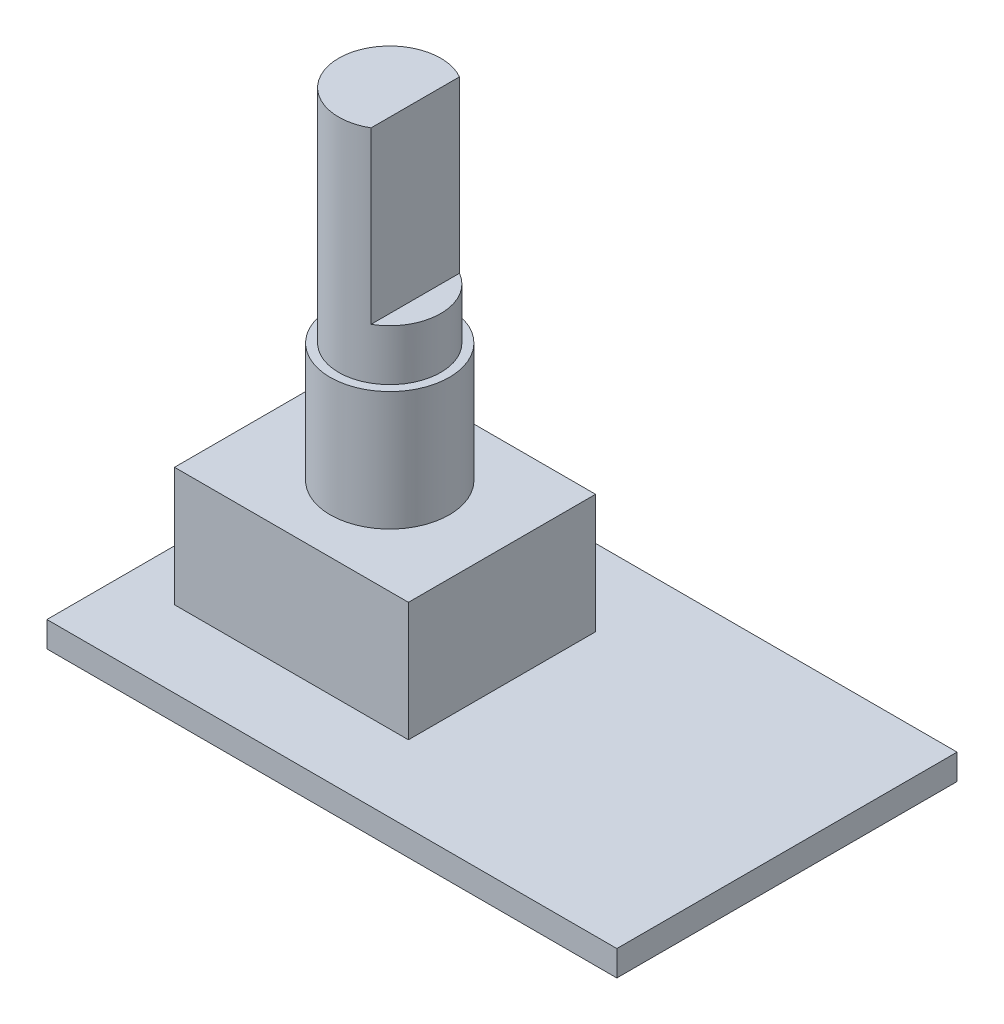
from build123d import *

# Parameters (mm, degrees)
SKETCH1_W           = 33.5
SKETCH1_H           = 20
BOSS_EXTRUDE1_DEPTH = 1.5
SKETCH2_W           = 13.75
SKETCH2_H           = 11
BOSS_EXTRUDE2_DEPTH = 7
SKETCH3_R           = 3.5
BOSS_EXTRUDE3_DEPTH = 7
SKETCH4_R           = 3
BOSS_EXTRUDE4_DEPTH = 13
CUT_EXTRUDE1_START  = -10
CUT_EXTRUDE1_DEPTH  = 10


with BuildPart() as part:
    # Sketch1 → Boss-Extrude1 (new body)
    with BuildSketch(Plane(origin=(0, 0, 0), x_dir=(1, 0, 0), z_dir=(0, 1, 0))):
        with Locations((7.887566138, -1.935185185)):
            Rectangle(SKETCH1_W, SKETCH1_H)
    extrude(amount=BOSS_EXTRUDE1_DEPTH)

    # Sketch2 → Boss-Extrude2 (add)
    with BuildSketch(Plane(origin=(0, 1.5, 0), x_dir=(1, 0, 0), z_dir=(0, 1, 0))):
        with Locations((1.012566138, -1.935185185)):
            Rectangle(SKETCH2_W, SKETCH2_H)
    extrude(amount=BOSS_EXTRUDE2_DEPTH)

    # Sketch3 → Boss-Extrude3 (add)
    with BuildSketch(Plane(origin=(0, 8.5, 0), x_dir=(1, 0, 0), z_dir=(0, 1, 0))):
        with Locations(Location((1.137566138, -1.784110138, 0), (0, 0, 270))):
            Circle(SKETCH3_R)
    extrude(amount=BOSS_EXTRUDE3_DEPTH)

    # Sketch4 → Boss-Extrude4 (add)
    with BuildSketch(Plane(origin=(0, 15.5, 0), x_dir=(1, 0, 0), z_dir=(0, 1, 0))):
        with Locations(Location((1.137566138, -1.784110138, 0), (0, 0, 90))):
            Circle(SKETCH4_R)
    extrude(amount=BOSS_EXTRUDE4_DEPTH)

    # Sketch5 → Cut-Extrude1 (cut)
    with BuildSketch(Plane(origin=(0, 28.5, 0), x_dir=(1, 0, 0), z_dir=(0, 1, 0)).offset(CUT_EXTRUDE1_START)):
        with BuildLine():
            Line((2.637566138, -1.784110138), (2.637566138, 0.813966073))
            ThreePointArc((2.637566138, 0.813966073), (4.137566138, -1.784110138), (2.637566138, -4.382186349))
            Line((2.637566138, -4.382186349), (2.637566138, -1.784110138))
        make_face()
    extrude(amount=CUT_EXTRUDE1_DEPTH, mode=Mode.SUBTRACT)


solid = part.part
